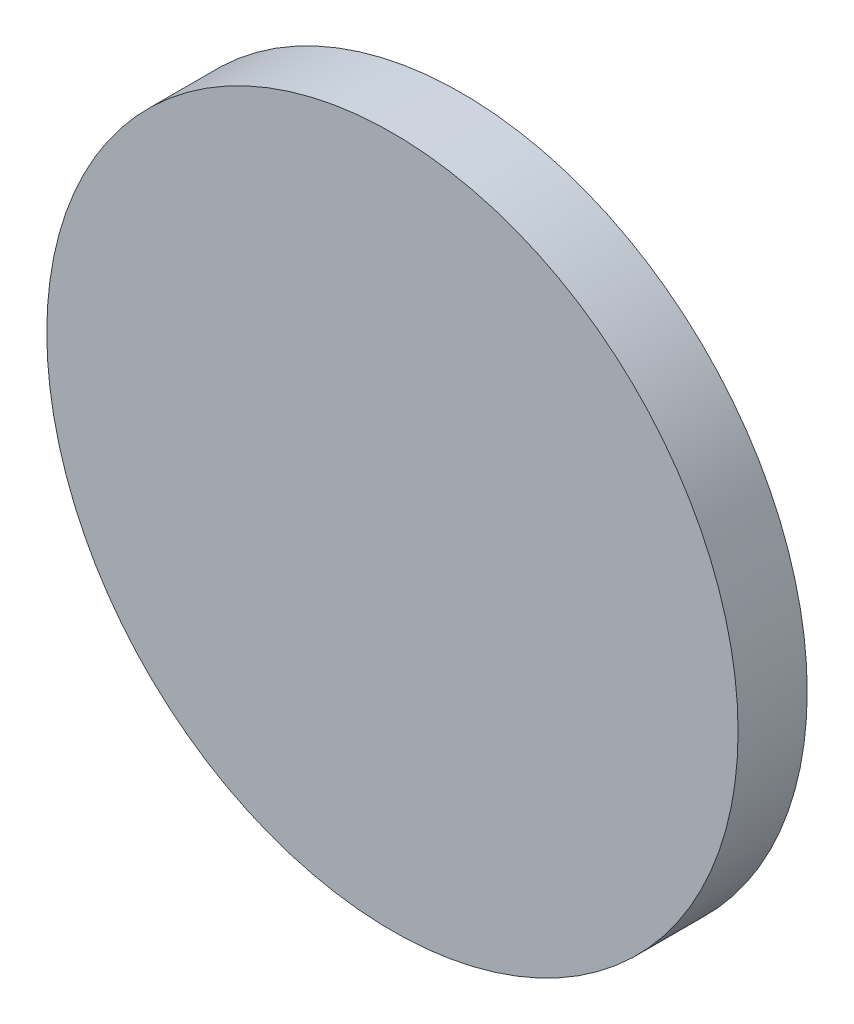
from build123d import *

# Parameters (mm, degrees)
SKETCH1_R           = 80
BOSS_EXTRUDE1_DEPTH = 16


with BuildPart() as part:
    # Sketch1 → Boss-Extrude1 (new body)
    with BuildSketch(Plane.XY):
        Circle(SKETCH1_R)
    extrude(amount=BOSS_EXTRUDE1_DEPTH)


solid = part.part
